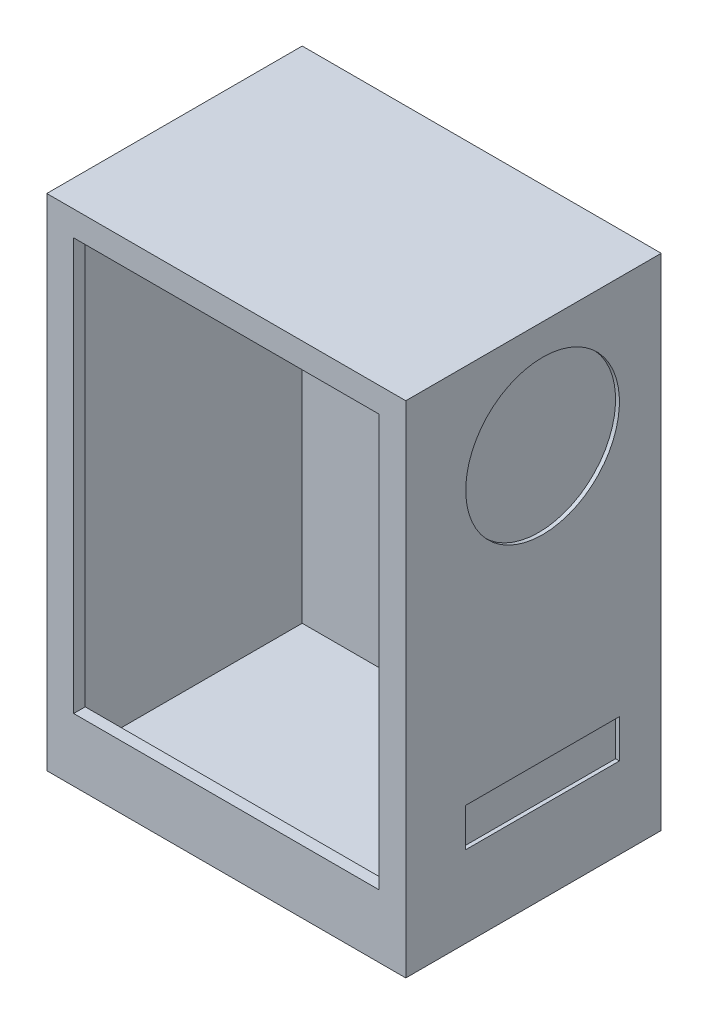
from build123d import *

# Parameters (mm, degrees)
SKETCH1_W           = 46.72
SKETCH1_H           = 65.06
SKETCH1_W_2         = 39.72
SKETCH1_H_2         = 53.61
BOSS_EXTRUDE1_DEPTH = 1.5
SKETCH1_3_W         = 46.72
SKETCH1_3_H         = 65.06
SKETCH1_3_W_2       = 43.72
SKETCH1_3_H_2       = 62.06
BOSS_EXTRUDE2_DEPTH = 30.24
SKETCH3_W           = 46.72
SKETCH3_H           = 65.06
SKETCH3_W_2         = 43.72
SKETCH3_H_2         = 62.06
SKETCH3_W_3         = 25.705
SKETCH3_H_3         = 50.55
BOSS_EXTRUDE3_DEPTH = 1.5
SKETCH4_R           = 10
SKETCH4_W           = 20
SKETCH4_H           = 5
CUT_EXTRUDE1_DEPTH  = 0.5


with BuildPart() as part:
    # Sketch1 → Boss-Extrude1 (new body)
    with BuildSketch(Plane.XY):
        with Locations((0, -2.475)):
            Rectangle(SKETCH1_W, SKETCH1_H)
        Rectangle(SKETCH1_W_2, SKETCH1_H_2, mode=Mode.SUBTRACT)
    extrude(amount=BOSS_EXTRUDE1_DEPTH)

    # Sketch1<3> → Boss-Extrude2 (add)
    with BuildSketch(Plane.XY):
        with Locations((0, -2.475)):
            Rectangle(SKETCH1_3_W, SKETCH1_3_H)
        with Locations((0, -2.475)):
            Rectangle(SKETCH1_3_W_2, SKETCH1_3_H_2, mode=Mode.SUBTRACT)
    extrude(amount=-BOSS_EXTRUDE2_DEPTH)

    # Sketch3 → Boss-Extrude3 (add)
    # profile 1 of 2: a face of its own
    with BuildSketch(Plane(origin=(0, 0, -30.24), x_dir=(-1, 0, 0), z_dir=(0, 0, -1))):
        with Locations((0, -2.475)):
            Rectangle(SKETCH3_W, SKETCH3_H)
        with Locations((0, -2.475)):
            Rectangle(SKETCH3_W_2, SKETCH3_H_2, mode=Mode.SUBTRACT)
    # profile 2 of 2: a face of its own
    with BuildSketch(Plane(origin=(0, 0, -30.24), x_dir=(-1, 0, 0), z_dir=(0, 0, -1))):
        with Locations((0, -2.475)):
            Rectangle(SKETCH3_W_2, SKETCH3_H_2)
        with Locations((-6.7605, 1.08)):
            Rectangle(SKETCH3_W_3, SKETCH3_H_3, mode=Mode.SUBTRACT)
    extrude(amount=BOSS_EXTRUDE3_DEPTH)

    # Sketch4 → Cut-Extrude1 (cut)
    with BuildSketch(Plane(origin=(23.36, 0, 0), x_dir=(0, 0, -1), z_dir=(1, 0, 0))):
        with Locations(Location((16.3, 16.055, 0), (0, 0, 90))):
            Circle(SKETCH4_R)
        with Locations((16.3, -21.945)):
            Rectangle(SKETCH4_W, SKETCH4_H)
    extrude(amount=-CUT_EXTRUDE1_DEPTH, mode=Mode.SUBTRACT)


solid = part.part
